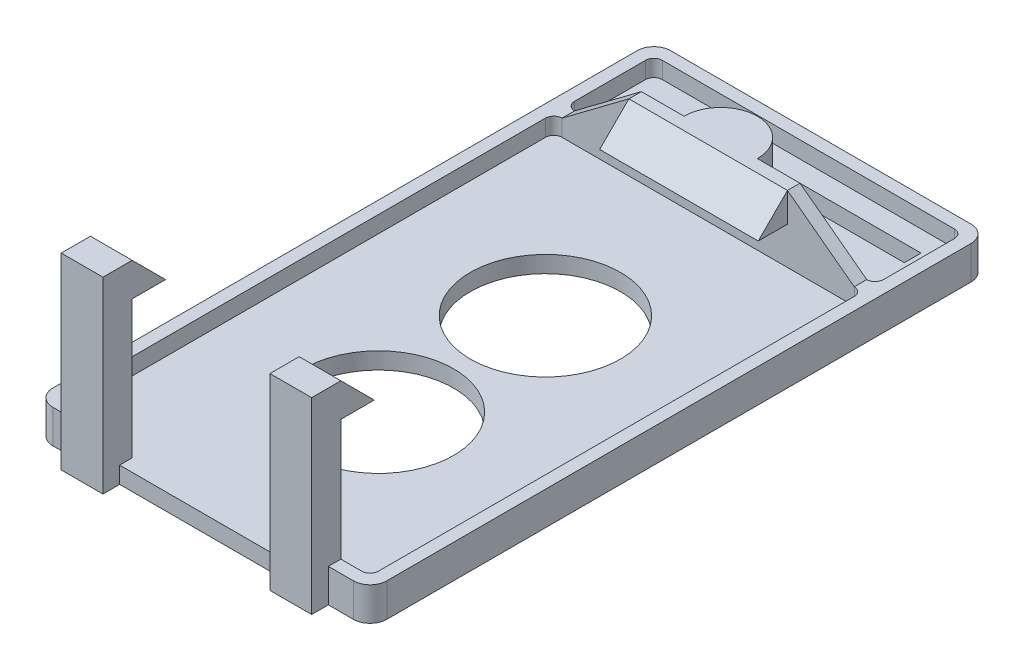
from build123d import *

# Parameters (mm, degrees)
BOSS_EXTRUDE1_DEPTH  = 1
PCB_HOLDER_52_R      = 4.5
BOSS_EXTRUDE2_DEPTH  = 1
BOSS_EXTRUDE3_DEPTH  = 2
PCB_HOLDER_57_W      = 17.5
PCB_HOLDER_57_H      = 0.75
BOSS_EXTRUDE7_DEPTH  = 5
SKETCH6_W            = 9.5
SKETCH6_H            = 1.75
BOSS_EXTRUDE9_DEPTH  = 1.75
CUT_EXTRUDE7_DEPTH   = 0.75
PCB_HOLDER_58_W      = 2.5
PCB_HOLDER_58_H      = 1
PCB_HOLDER_58_H_2    = 0.75
BOSS_EXTRUDE10_DEPTH = 11.25
SKETCH10_W           = 2.5
SKETCH10_H           = 2
BOSS_EXTRUDE11_DEPTH = 2
CUT_EXTRUDE8_DEPTH   = 15
CUT_EXTRUDE12_DEPTH  = 9.5
CUT_EXTRUDE17_DEPTH  = 1
BOSS_EXTRUDE12_START = 3
BOSS_EXTRUDE12_DEPTH = 3
SKETCH13_4_W         = 11
SKETCH13_4_H         = 1
CUT_EXTRUDE18_DEPTH  = 3


with BuildPart() as part:
    # PCB holder → Boss-Extrude1 (new body)
    with BuildSketch(Plane(origin=(0, 0, 0), x_dir=(1, 0, 0), z_dir=(0, 1, 0))):
        with BuildLine():
            Line((9, 21.5), (-9, 21.5))
            ThreePointArc((-9, 21.5), (-9.707106781, 21.207106781), (-10, 20.5))
            Line((-10, 20.5), (-10, -14.5))
            ThreePointArc((-10, -14.5), (-9.707106781, -15.207106781), (-9, -15.5))
            Line((-9, -15.5), (9, -15.5))
            ThreePointArc((9, -15.5), (9.707106781, -15.207106781), (10, -14.5))
            Line((10, -14.5), (10, 20.5))
            ThreePointArc((10, 20.5), (9.707106781, 21.207106781), (9, 21.5))
        make_face()
        with BuildLine():
            Line((9.25, 14.25), (9.25, -14.25))
            ThreePointArc((9.25, -14.25), (9.103553391, -14.603553391), (8.75, -14.75))
            Line((8.75, -14.75), (-8.75, -14.75))
            ThreePointArc((-8.75, -14.75), (-9.103553391, -14.603553391), (-9.25, -14.25))
            Line((-9.25, -14.25), (-9.25, 14.25))
            ThreePointArc((-9.25, 14.25), (-9.103553391, 14.603553391), (-8.75, 14.75))
            Line((-8.75, 14.75), (8.75, 14.75))
            ThreePointArc((8.75, 14.75), (9.103553391, 14.603553391), (9.25, 14.25))
        make_face(mode=Mode.SUBTRACT)
    extrude(amount=BOSS_EXTRUDE1_DEPTH)

    # PCB holder<52> → Boss-Extrude2 (add)
    with BuildSketch(Plane(origin=(0, 0, 0), x_dir=(1, 0, 0), z_dir=(0, 1, 0))):
        with BuildLine():
            Line((-9.25, 14.25), (-9.25, -14.25))
            ThreePointArc((-9.25, -14.25), (-9.103553391, -14.603553391), (-8.75, -14.75))
            Line((-8.75, -14.75), (8.75, -14.75))
            ThreePointArc((8.75, -14.75), (9.103553391, -14.603553391), (9.25, -14.25))
            Line((9.25, -14.25), (9.25, 14.25))
            ThreePointArc((9.25, 14.25), (9.103553391, 14.603553391), (8.75, 14.75))
            Line((8.75, 14.75), (-8.75, 14.75))
            ThreePointArc((-8.75, 14.75), (-9.103553391, 14.603553391), (-9.25, 14.25))
        make_face()
        with Locations(Location((0, -5, 0), (0, 0, 270))):
            Circle(PCB_HOLDER_52_R, mode=Mode.SUBTRACT)
        with Locations(Location((0, 5, 0), (0, 0, 270))):
            Circle(PCB_HOLDER_52_R, mode=Mode.SUBTRACT)
    extrude(amount=BOSS_EXTRUDE2_DEPTH)

    # PCB holder<55> → Boss-Extrude3 (add)
    with BuildSketch(Plane(origin=(0, 0, 0), x_dir=(1, 0, 0), z_dir=(0, 1, 0))):
        with BuildLine():
            Line((8.75, 15.5), (8.75, 14.75))
            ThreePointArc((8.75, 14.75), (9.103553391, 14.603553391), (9.25, 14.25))
            Line((9.25, 14.25), (9.25, -14.25))
            ThreePointArc((9.25, -14.25), (9.103553391, -14.603553391), (8.75, -14.75))
            Line((8.75, -14.75), (7.5, -14.75))
            Line((7.5, -14.75), (7.5, -15.5))
            Line((7.5, -15.5), (9, -15.5))
            ThreePointArc((9, -15.5), (9.707106781, -15.207106781), (10, -14.5))
            Line((10, -14.5), (10, 20.5))
            ThreePointArc((10, 20.5), (9.707106781, 21.207106781), (9, 21.5))
            Line((9, 21.5), (-9, 21.5))
            ThreePointArc((-9, 21.5), (-9.707106781, 21.207106781), (-10, 20.5))
            Line((-10, 20.5), (-10, -14.5))
            ThreePointArc((-10, -14.5), (-9.707106781, -15.207106781), (-9, -15.5))
            Line((-9, -15.5), (-7.5, -15.5))
            Line((-7.5, -15.5), (-7.5, -14.75))
            Line((-7.5, -14.75), (-8.75, -14.75))
            ThreePointArc((-8.75, -14.75), (-9.103553391, -14.603553391), (-9.25, -14.25))
            Line((-9.25, -14.25), (-9.25, 14.25))
            ThreePointArc((-9.25, 14.25), (-9.103553391, 14.603553391), (-8.75, 14.75))
            Line((-8.75, 14.75), (-8.75, 15.5))
            Line((-8.75, 15.5), (8.75, 15.5))
        make_face()
    extrude(amount=BOSS_EXTRUDE3_DEPTH)

    # PCB holder<57> → Boss-Extrude7 (add)
    with BuildSketch(Plane(origin=(0, 0, 0), x_dir=(1, 0, 0), z_dir=(0, 1, 0))):
        with Locations((0, 15.125)):
            Rectangle(PCB_HOLDER_57_W, PCB_HOLDER_57_H)
    extrude(amount=BOSS_EXTRUDE7_DEPTH)

    # Sketch6 → Boss-Extrude9 (add)
    with BuildSketch(Plane.XY.offset(-14.75)):
        with Locations((0, 4.125)):
            Rectangle(SKETCH6_W, SKETCH6_H)
    extrude(amount=BOSS_EXTRUDE9_DEPTH)

    # Sketch8 → Cut-Extrude7 (cut)
    with BuildSketch(Plane.XY.offset(-14.75)):
        Polygon((4.75, 5), (8.75, 2), (8.75, 5), align=None)
        Polygon((-4.75, 5), (-8.75, 2), (-8.75, 5), align=None)
    extrude(amount=-CUT_EXTRUDE7_DEPTH, mode=Mode.SUBTRACT)

    # PCB holder<58> → Boss-Extrude10 (add)
    with BuildSketch(Plane(origin=(0, 0, 0), x_dir=(1, 0, 0), z_dir=(0, 1, 0))):
        with Locations((-6.25, -16)):
            Rectangle(PCB_HOLDER_58_W, PCB_HOLDER_58_H)
        with Locations((-6.25, -15.125)):
            Rectangle(PCB_HOLDER_58_W, PCB_HOLDER_58_H_2)
        with Locations((6.25, -16)):
            Rectangle(PCB_HOLDER_58_W, PCB_HOLDER_58_H)
        with Locations((6.25, -15.125)):
            Rectangle(PCB_HOLDER_58_W, PCB_HOLDER_58_H_2)
    extrude(amount=BOSS_EXTRUDE10_DEPTH)

    # Sketch10 → Boss-Extrude11 (add)
    with BuildSketch(Plane(origin=(0, 0, 14.75), x_dir=(-1, 0, 0), z_dir=(0, 0, -1))):
        with Locations((-6.25, 10.25)):
            Rectangle(SKETCH10_W, SKETCH10_H)
        with Locations((6.25, 10.25)):
            Rectangle(SKETCH10_W, SKETCH10_H)
    extrude(amount=BOSS_EXTRUDE11_DEPTH)

    # Sketch11 → Cut-Extrude8 (cut)
    with BuildSketch(Plane(origin=(7.5, 0, 0), x_dir=(0, 0, -1), z_dir=(1, 0, 0))):
        Polygon((-14.75, 11.25), (-12.75, 9.25), (-12.75, 11.25), align=None)
    extrude(amount=-CUT_EXTRUDE8_DEPTH, mode=Mode.SUBTRACT)

    # Sketch7 → Cut-Extrude12 (cut)
    with BuildSketch(Plane(origin=(4.75, 0, 0), x_dir=(0, 0, -1), z_dir=(1, 0, 0))):
        Polygon((13, 3.25), (14.75, 5), (13, 5), align=None)
    extrude(amount=-CUT_EXTRUDE12_DEPTH, mode=Mode.SUBTRACT)

    # Sketch13 → Cut-Extrude17 (cut)
    with BuildSketch(Plane(origin=(0, 2, 0), x_dir=(1, 0, 0), z_dir=(0, 1, 0))):
        with BuildLine():
            Line((8.75, 20.75), (-8.75, 20.75))
            ThreePointArc((-8.75, 20.75), (-9.103553391, 20.603553391), (-9.25, 20.25))
            Line((-9.25, 20.25), (-9.25, 16))
            ThreePointArc((-9.25, 16), (-9.103553391, 15.646446609), (-8.75, 15.5))
            Line((-8.75, 15.5), (-2.197469764, 15.5))
            ThreePointArc((-2.197469764, 15.5), (0, 17.697469764), (2.197469764, 15.5))
            Line((2.197469764, 15.5), (8.75, 15.5))
            ThreePointArc((8.75, 15.5), (9.103553391, 15.646446609), (9.25, 16))
            Line((9.25, 16), (9.25, 20.25))
            ThreePointArc((9.25, 20.25), (9.103553391, 20.603553391), (8.75, 20.75))
        make_face()
    extrude(amount=-CUT_EXTRUDE17_DEPTH, mode=Mode.SUBTRACT)

    # Sketch13<3> → Boss-Extrude12 (add)
    with BuildSketch(Plane(origin=(0, 2, 0), x_dir=(1, 0, 0), z_dir=(0, 1, 0)).offset(BOSS_EXTRUDE12_START)):
        with BuildLine():
            ThreePointArc((2.197469764, 15.5), (0, 17.697469764), (-2.197469764, 15.5))
            Line((-2.197469764, 15.5), (2.197469764, 15.5))
        make_face()
    extrude(amount=-BOSS_EXTRUDE12_DEPTH)

    # Sketch13<4> → Cut-Extrude18 (cut)
    with BuildSketch(Plane(origin=(0, 2, 0), x_dir=(1, 0, 0), z_dir=(0, 1, 0))):
        with Locations((2.5, 19)):
            Rectangle(SKETCH13_4_W, SKETCH13_4_H)
    extrude(amount=-CUT_EXTRUDE18_DEPTH, mode=Mode.SUBTRACT)


solid = part.part
